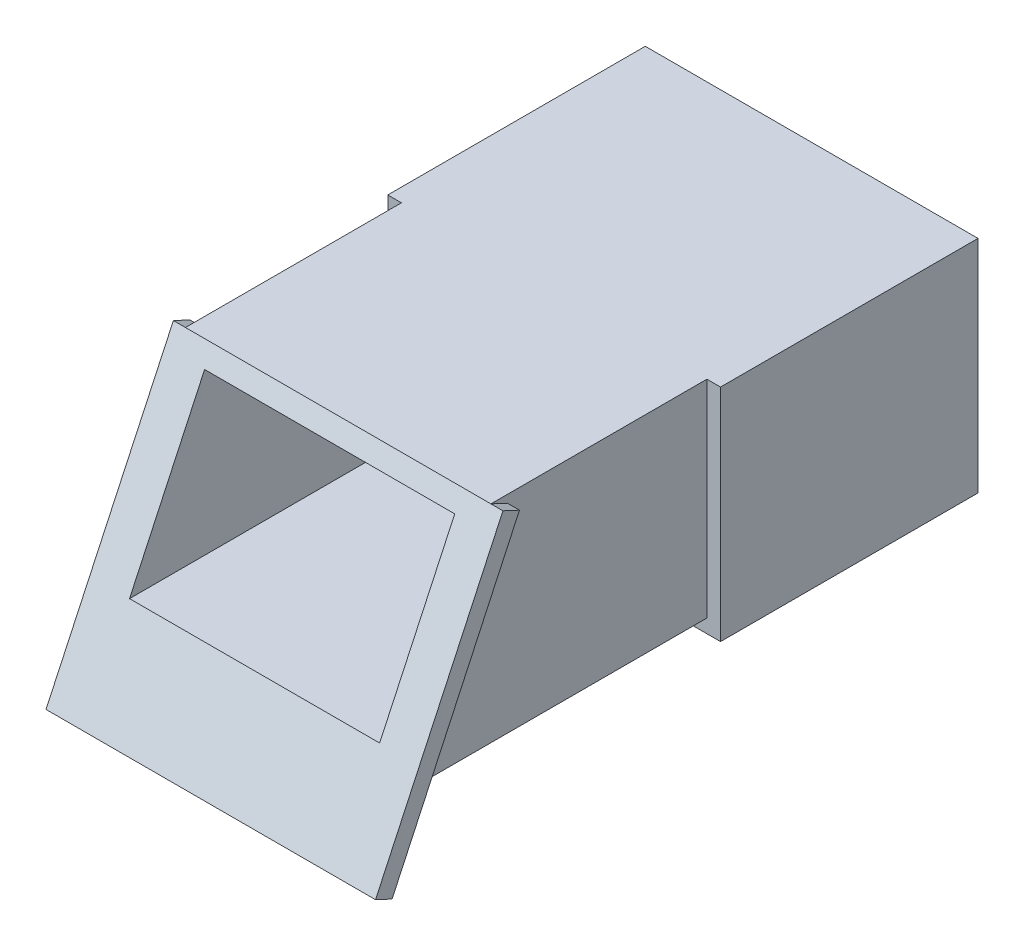
from build123d import *

# Parameters (mm, degrees)
CROQUIS1_W               = 53.24
CROQUIS1_H               = 35.28
CROQUIS1_W_2             = 46.88
CROQUIS1_H_2             = 29.18
SALIENTE_EXTRUIR2_DEPTH  = 41.2
CROQUIS3_W               = 48.88
CROQUIS3_H               = 33.1
CROQUIS3_W_2             = 40.02
CROQUIS3_H_2             = 25.75
SALIENTE_EXTRUIR11_DEPTH = 50
CROQUIS21_W              = 51.220456713
CROQUIS21_H              = 38.403596391
CORTAR_EXTRUIR1_DEPTH    = 24
CROQUIS22_W              = 52.73
CROQUIS22_H              = 48.22
SALIENTE_EXTRUIR15_DEPTH = 2.92
CROQUIS24_W              = 40.02
CROQUIS24_H              = 25.75
CORTAR_EXTRUIR2_DEPTH    = 81.92


with BuildPart() as part:
    # Croquis1 → Saliente-Extruir2 (new body)
    with BuildSketch(Plane.XY):
        with Locations((-10.511813518, 0.307314635)):
            Rectangle(CROQUIS1_W, CROQUIS1_H)
        with Locations((-10.511813518, 0.437314635)):
            Rectangle(CROQUIS1_W_2, CROQUIS1_H_2, mode=Mode.SUBTRACT)
    extrude(amount=SALIENTE_EXTRUIR2_DEPTH)

    # Croquis3 → Saliente-Extruir11 (add)
    with BuildSketch(Plane.XY.offset(41.2)):
        with Locations((-10.511813518, 1.397314635)):
            Rectangle(CROQUIS3_W, CROQUIS3_H)
        with Locations((-10.511813518, 2.152314635)):
            Rectangle(CROQUIS3_W_2, CROQUIS3_H_2, mode=Mode.SUBTRACT)
    extrude(amount=SALIENTE_EXTRUIR11_DEPTH)

    # Croquis21 → Cortar-Extruir1 (cut)
    with BuildSketch(Plane(origin=(0, 32.232144696, 69.095644301), x_dir=(-1, 0, 0), z_dir=(0, -0.4227509471843472, -0.906245902972663))):
        with Locations((10.82223744, -34.046833933)):
            Rectangle(CROQUIS21_W, CROQUIS21_H)
    extrude(amount=-CORTAR_EXTRUIR1_DEPTH, mode=Mode.SUBTRACT)

    # Croquis22 → Saliente-Extruir15 (add)
    with BuildSketch(Plane(origin=(0, 32.232144696, 69.095644301), x_dir=(-1, 0, 0), z_dir=(0, -0.4227509471843472, -0.906245902972663))):
        with Locations((10.511813518, -39.872642362)):
            Rectangle(CROQUIS22_W, CROQUIS22_H)
    extrude(amount=SALIENTE_EXTRUIR15_DEPTH)

    # Croquis24 → Cortar-Extruir2 (cut)
    with BuildSketch(Plane.XY.offset(41.2)):
        with Locations((-10.511813518, 2.152314635)):
            Rectangle(CROQUIS24_W, CROQUIS24_H)
    extrude(amount=CORTAR_EXTRUIR2_DEPTH, mode=Mode.SUBTRACT)


solid = part.part
